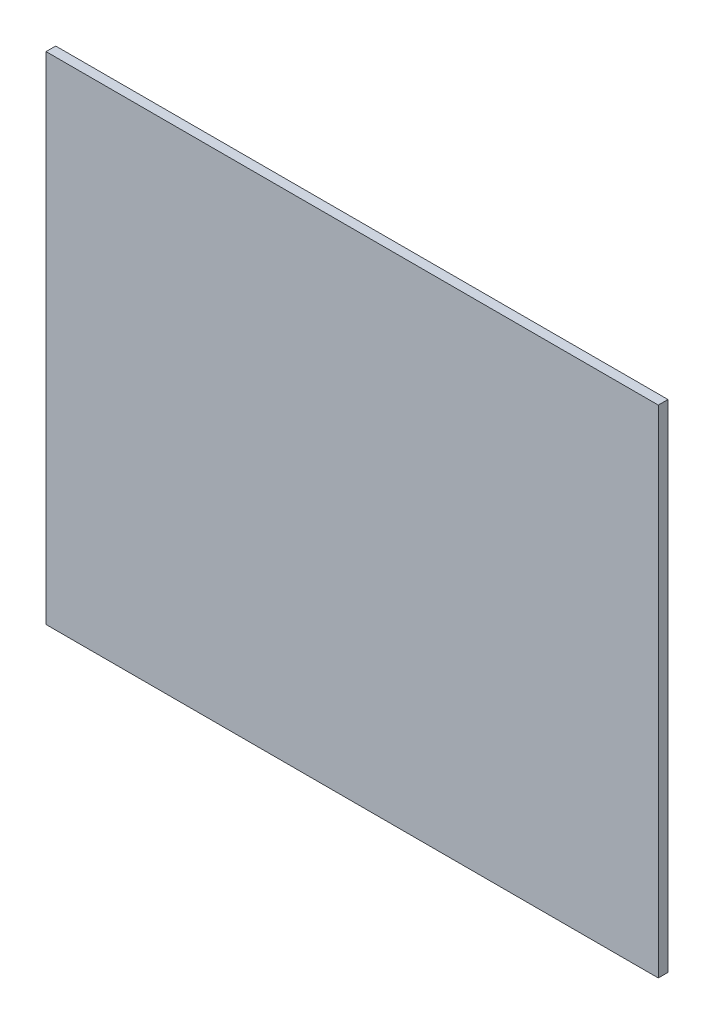
from build123d import *

# Parameters (mm, degrees)
SKETCH2_W           = 63.3
SKETCH2_H           = 51.3
BOSS_EXTRUDE1_DEPTH = 1


with BuildPart() as part:
    # Sketch2 → Boss-Extrude1 (new body)
    with BuildSketch(Plane.XY):
        with Locations((-0.665932521, -8.049250234)):
            Rectangle(SKETCH2_W, SKETCH2_H)
    extrude(amount=BOSS_EXTRUDE1_DEPTH)


solid = part.part
